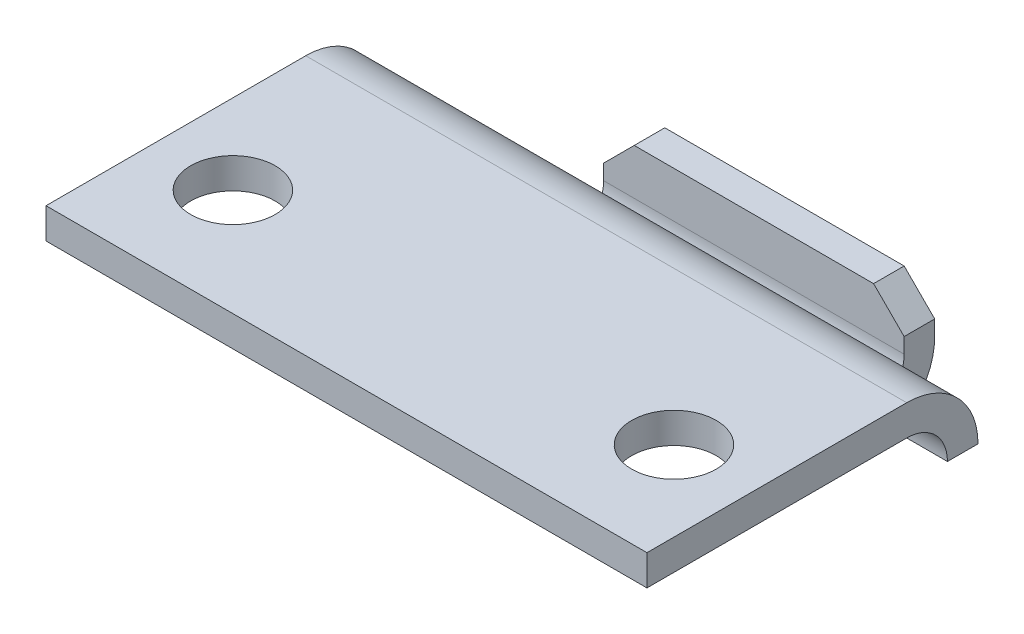
from build123d import *

# Parameters (mm, degrees)
EXTRUDE1_DEPTH     = 14.986
SKETCH3_W          = 10.126198966
SKETCH3_H          = 9.525984496
CUT_EXTRUDE1_DEPTH = 24.44276897
SKETCH4_W          = 11.338244961
SKETCH4_H          = 6.180272868
SKETCH4_W_2        = 9.014834109
SKETCH4_H_2        = 6.970232558
CUT_EXTRUDE2_DEPTH = 24.44276897
CHAMFER1_SIZE      = 1.524
SKETCH5_R          = 2.1082
CUT_EXTRUDE3_DEPTH = 24.44276897


with BuildPart() as part:
    # Sketch2 → Extrude1 (new, symmetric)
    with BuildSketch(Plane(origin=(0, 0, 0), x_dir=(0, 0, -1), z_dir=(1, 0, 0))):
        with BuildLine():
            Line((-5.334, 0), (7.62, 0))
            ThreePointArc((7.62, 0), (9.056840979, -0.595159021), (9.652, -2.032))
            Line((9.652, -2.032), (9.652, -3.81))
            ThreePointArc((9.652, -3.81), (13.081, -7.239), (16.51, -3.81))
            Line((16.51, -3.81), (16.51, -1.524))
            Line((16.51, -1.524), (14.986, -1.524))
            Line((14.986, -1.524), (14.986, -3.81))
            ThreePointArc((14.986, -3.81), (13.081, -5.715), (11.176, -3.81))
            Line((11.176, -3.81), (11.176, -2.032))
            ThreePointArc((11.176, -2.032), (10.134471714, 0.482471714), (7.62, 1.524))
            Line((7.62, 1.524), (-5.334, 1.524))
            Line((-5.334, 1.524), (-5.334, 0))
        make_face()
    extrude(amount=EXTRUDE1_DEPTH, both=True)

    # Sketch3 → Cut-Extrude1 (cut, through all)
    with BuildSketch(Plane.XY):
        with Locations((-12.556099483, -6.794992248)):
            Rectangle(SKETCH3_W, SKETCH3_H)
        with Locations((12.556099483, -6.794992248)):
            Rectangle(SKETCH3_W, SKETCH3_H)
    extrude(amount=-CUT_EXTRUDE1_DEPTH, mode=Mode.SUBTRACT)

    # Sketch4 → Cut-Extrude2 (cut, through all)
    with BuildSketch(Plane(origin=(0, 0, 0), x_dir=(1, 0, 0), z_dir=(0, 1, 0))):
        with Locations((-13.16212248, 16.740372093)):
            Rectangle(SKETCH4_W, SKETCH4_H)
        with Locations((12.000417055, 16.577733333)):
            Rectangle(SKETCH4_W_2, SKETCH4_H_2)
    extrude(amount=-CUT_EXTRUDE2_DEPTH, mode=Mode.SUBTRACT)

    # Chamfer1
    chamfer1_edges = [part.edges().sort_by_distance(p)[0] for p in [
        (7.493, -1.524, -15.748),
        (-7.493, -1.524, -15.748),
    ]]
    chamfer(chamfer1_edges, length=CHAMFER1_SIZE)

    # Sketch5 → Cut-Extrude3 (cut, through all)
    with BuildSketch(Plane(origin=(0, 0, 0), x_dir=(1, 0, 0), z_dir=(0, 1, 0))):
        with Locations(Location((10.9982, 0, 0), (0, 0, 270))):
            Circle(SKETCH5_R)
        with Locations(Location((-10.9982, 0, 0), (0, 0, 90))):
            Circle(SKETCH5_R)
    extrude(amount=CUT_EXTRUDE3_DEPTH, mode=Mode.SUBTRACT)


solid = part.part
